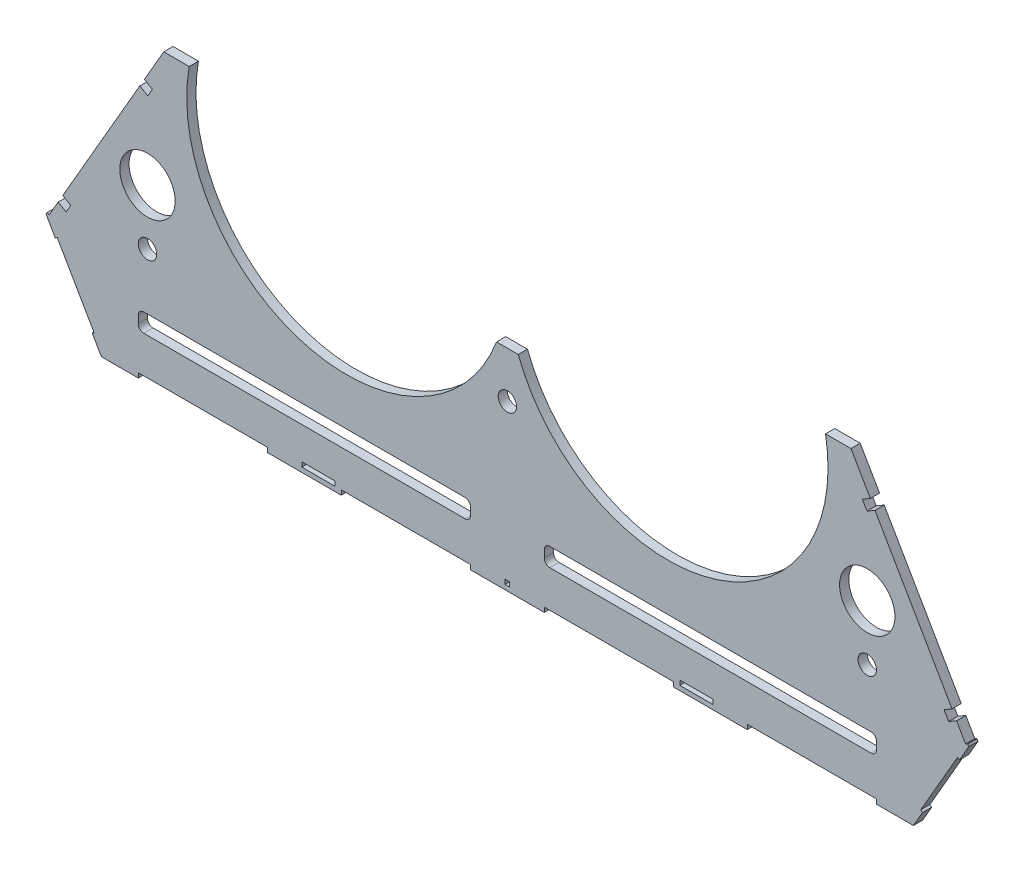
from build123d import *

# Parameters (mm, degrees)
BOSS_EXTRUDE1_DEPTH       = 6.35
SKETCH4_W                 = 88.9
SKETCH4_H                 = 3.175
CUT_EXTRUDE1_DEPTH        = 378.010361263
CUT_EXTRUDE2_DEPTH        = 378.010361263
CUT_EXTRUDE5_DEPTH        = 378.010361263
CUT_EXTRUDE6_DEPTH        = 378.010361263
SKETCH12_W                = 22.86
SKETCH12_H                = 3.175
SKETCH12_W_2              = 3.175
CUT_EXTRUDE8_DEPTH        = 378.010361263
NYLON_BOLT_CUT_REACH      = 379.01
SKETCH13_R                = 6.35
SKETCH14_R                = 19.05
CUT_EXTRUDE9_DEPTH        = 378.010361263
SKETCH15_R                = 6.35
STATIC_PAYLOAD_BOLT_DEPTH = 378.010361263
CUT_EXTRUDE10_DEPTH       = 378.010361263


with BuildPart() as part:
    # Sketch3 → Boss-Extrude1 (new body)
    with BuildSketch(Plane.XY):
        with BuildLine():
            Line((-317.5, 65.991135768), (-279.4, 0))
            Line((-279.4, 0), (279.4, 0))
            Line((279.4, 0), (317.5, 65.991135768))
            Line((317.5, 65.991135768), (238.282425301, 203.2))
            Line((238.282425301, 203.2), (218.930796924, 203.2))
            ThreePointArc((218.930796924, 203.2), (194.958955891, 113.108264062), (110.49, 73.66))
            ThreePointArc((110.49, 73.66), (47.902002926, 93.167184987), (7.48041253, 144.78))
            Line((7.48041253, 144.78), (-7.48041253, 144.78))
            ThreePointArc((-7.48041253, 144.78), (-47.902002926, 93.167184987), (-110.49, 73.66))
            ThreePointArc((-110.49, 73.66), (-194.958955891, 113.108264062), (-218.930796924, 203.2))
            Line((-218.930796924, 203.2), (-238.282425301, 203.2))
            Line((-238.282425301, 203.2), (-317.5, 65.991135768))
        make_face()
    extrude(amount=BOSS_EXTRUDE1_DEPTH)

    # Sketch4 → Cut-Extrude1 (cut, through all)
    with BuildSketch(Plane.XY.offset(6.35)):
        with Locations((-209.55, 1.5875)):
            Rectangle(SKETCH4_W, SKETCH4_H)
        with Locations((-69.85, 1.5875)):
            Rectangle(SKETCH4_W, SKETCH4_H)
        with Locations((69.85, 1.5875)):
            Rectangle(SKETCH4_W, SKETCH4_H)
        with Locations((209.55, 1.5875)):
            Rectangle(SKETCH4_W, SKETCH4_H)
    extrude(amount=-CUT_EXTRUDE1_DEPTH, mode=Mode.SUBTRACT)

    # Sketch5 → Cut-Extrude2 (cut, through all)
    with BuildSketch(Plane.XY.offset(6.35)):
        Polygon((-311.15, 54.99261314), (-309.775184671, 55.78636314), (-284.375184671, 11.792272628), (-285.75, 10.998522628), align=None)
        Polygon((285.75, 10.998522628), (311.15, 54.99261314), (309.775184671, 55.78636314), (284.375184671, 11.792272628), align=None)
    extrude(amount=-CUT_EXTRUDE2_DEPTH, mode=Mode.SUBTRACT)

    # Sketch8 → Cut-Extrude5 (cut, through all)
    with BuildSketch(Plane.XY.offset(6.35)):
        Polygon((-315.363184671, 66.517208484), (-236.449338196, 203.2), (-238.282425301, 203.2), (-316.738, 67.310958484), align=None)
        Polygon((316.738, 67.310958484), (315.363184671, 66.517208484), (236.449338196, 203.2), (238.282425301, 203.2), align=None)
    extrude(amount=-CUT_EXTRUDE5_DEPTH, mode=Mode.SUBTRACT)

    # Sketch9 → Cut-Extrude6 (cut, through all)
    with BuildSketch(Plane.XY.offset(6.35)):
        Polygon((-252.959338196, 174.603841167), (-247.460076882, 171.428841167), (-244.285076882, 176.928102481), (-249.784338196, 180.103102481), align=None)
        Polygon((249.784338196, 180.103102481), (252.959338196, 174.603841167), (247.460076882, 171.428841167), (244.285076882, 176.928102481), align=None)
        Polygon((-303.640923357, 74.120760659), (-300.465923357, 79.620021973), (-305.965184671, 82.795021973), (-309.140184671, 77.295760659), align=None)
        Polygon((305.965184671, 82.795021973), (309.140184671, 77.295760659), (303.640923357, 74.120760659), (300.465923357, 79.620021973), align=None)
    extrude(amount=-CUT_EXTRUDE6_DEPTH, mode=Mode.SUBTRACT)

    # Sketch12 → Cut-Extrude8 (cut, through all)
    with BuildSketch(Plane.XY.offset(6.35)):
        with Locations((-130.048, 4.7625)):
            Rectangle(SKETCH12_W, SKETCH12_H)
        with Locations((130.048, 4.7625)):
            Rectangle(SKETCH12_W, SKETCH12_H)
        with Locations((0, 4.7625)):
            Rectangle(SKETCH12_W_2, SKETCH12_H)
    extrude(amount=-CUT_EXTRUDE8_DEPTH, mode=Mode.SUBTRACT)

    # Sketch13 → nylon bolt cut (cut, up to next)
    with BuildSketch(Plane(origin=(0, 0, 0), x_dir=(-1, 0, 0), z_dir=(0, 0, -1)), mode=Mode.PRIVATE) as nylon_bolt_cut_sk1:
        with Locations((-247.65, 80.01)):
            Circle(SKETCH13_R)
    nylon_bolt_cut_tool1 = extrude(nylon_bolt_cut_sk1.sketch, amount=-NYLON_BOLT_CUT_REACH, mode=Mode.PRIVATE) & part.part
    # Sketch13 → nylon bolt cut (cut, up to next)
    with BuildSketch(Plane(origin=(0, 0, 0), x_dir=(-1, 0, 0), z_dir=(0, 0, -1)), mode=Mode.PRIVATE) as nylon_bolt_cut_sk2:
        with Locations(Location((247.65, 80.01, 0), (0, 0, 180))):
            Circle(SKETCH13_R)
    nylon_bolt_cut_tool2 = extrude(nylon_bolt_cut_sk2.sketch, amount=-NYLON_BOLT_CUT_REACH, mode=Mode.PRIVATE) & part.part
    add(nylon_bolt_cut_tool1.solids().sort_by_distance((247.65, 80.01, 0))[0], mode=Mode.SUBTRACT)
    add(nylon_bolt_cut_tool2.solids().sort_by_distance((-247.65, 80.01, 0))[0], mode=Mode.SUBTRACT)

    # Sketch14 → Cut-Extrude9 (cut, through all)
    with BuildSketch(Plane.XY.offset(6.35)):
        with Locations((-247.65, 118.11)):
            Circle(SKETCH14_R)
        with Locations(Location((247.65, 118.11, 0), (0, 0, 180))):
            Circle(SKETCH14_R)
    extrude(amount=-CUT_EXTRUDE9_DEPTH, mode=Mode.SUBTRACT)

    # Sketch15 → static payload bolt (cut, through all)
    with BuildSketch(Plane.XY.offset(6.35)):
        with Locations((0, 113.03)):
            Circle(SKETCH15_R)
    extrude(amount=-STATIC_PAYLOAD_BOLT_DEPTH, mode=Mode.SUBTRACT)

    # Sketch16 → Cut-Extrude10 (cut, through all)
    with BuildSketch(Plane.XY.offset(6.35)):
        with BuildLine():
            Line((-250.19, 41.275), (-29.21, 41.275))
            ThreePointArc((-29.21, 41.275), (-26.515923164, 40.159076836), (-25.4, 37.465))
            Line((-25.4, 37.465), (-25.4, 32.385))
            ThreePointArc((-25.4, 32.385), (-26.515923164, 29.690923164), (-29.21, 28.575))
            Line((-29.21, 28.575), (-250.19, 28.575))
            ThreePointArc((-250.19, 28.575), (-252.884076836, 29.690923164), (-254, 32.385))
            Line((-254, 32.385), (-254, 37.465))
            ThreePointArc((-254, 37.465), (-252.884076836, 40.159076836), (-250.19, 41.275))
        make_face()
        with BuildLine():
            Line((254, 37.465), (254, 32.385))
            ThreePointArc((254, 32.385), (252.884076836, 29.690923164), (250.19, 28.575))
            Line((250.19, 28.575), (29.21, 28.575))
            ThreePointArc((29.21, 28.575), (26.515923164, 29.690923164), (25.4, 32.385))
            Line((25.4, 32.385), (25.4, 37.465))
            ThreePointArc((25.4, 37.465), (26.515923164, 40.159076836), (29.21, 41.275))
            Line((29.21, 41.275), (250.19, 41.275))
            ThreePointArc((250.19, 41.275), (252.884076836, 40.159076836), (254, 37.465))
        make_face()
    extrude(amount=-CUT_EXTRUDE10_DEPTH, mode=Mode.SUBTRACT)


solid = part.part
